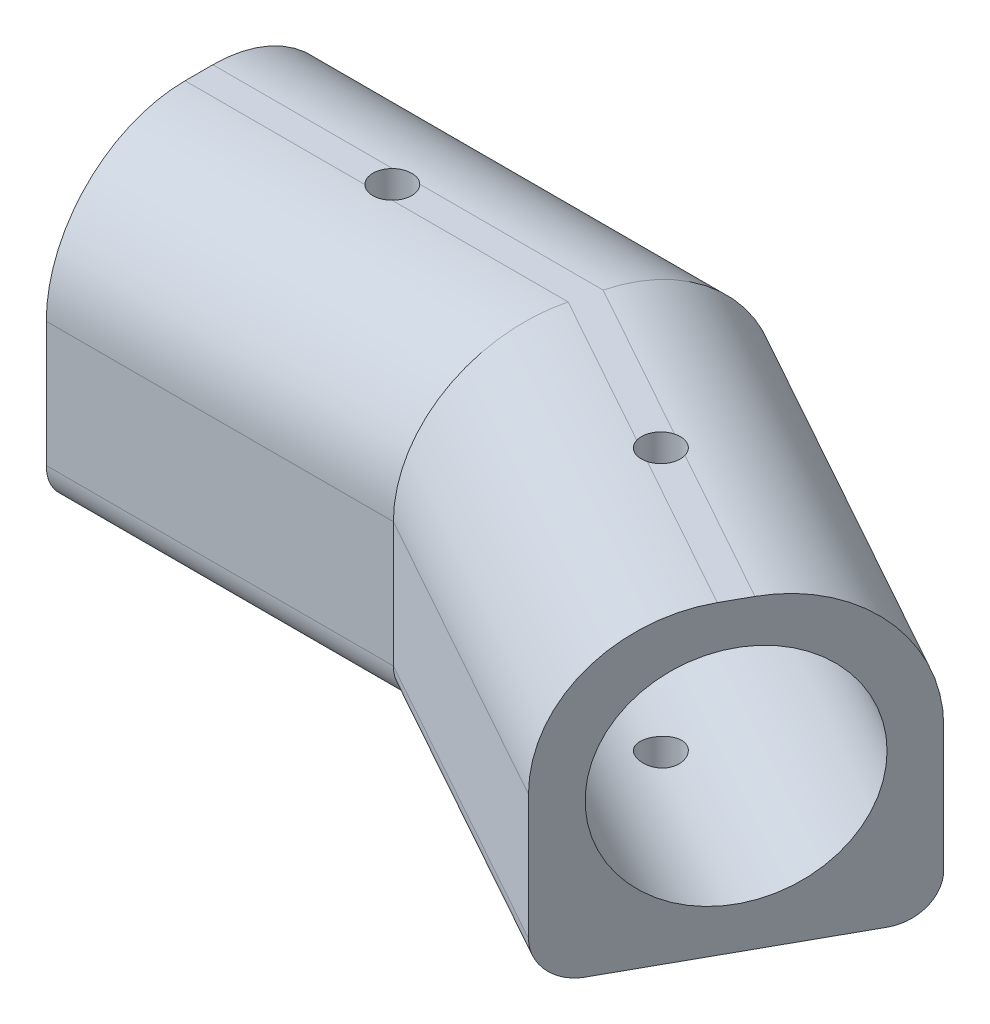
from build123d import *

# Parameters (mm, degrees)
BOSS_EXTRUDE3_DEPTH = 22
CUT_EXTRUDE4_DEPTH  = 59.108375
CUT_EXTRUDE5_REACH  = 125.396
SKETCH5_R           = 8
CUT_EXTRUDE6_REACH  = 125.396
SKETCH7_R           = 8
FILLET1_R           = 10
CUT_EXTRUDE9_DEPTH  = 28.41
CUT_EXTRUDE10_DEPTH = 33.85
BOSS_EXTRUDE4_REACH = 60.461
BOSS_EXTRUDE5_REACH = 60.461
BOSS_EXTRUDE6_REACH = 60.461
BOSS_EXTRUDE7_REACH = 60.461
CUT_EXTRUDE11_DEPTH = 40
FILLET2_R           = 3


with BuildPart() as part:
    # Sketch1 → Boss-Extrude3 (new body)
    with BuildSketch(Plane(origin=(0, 0, 0), x_dir=(1, 0, 0), z_dir=(0, 1, 0))):
        Polygon((36.111730264, -52.557630883), (46.787036785, -33.321263484), (-9.652310469, -2), (-68.760685704, -2), (-68.760685704, -24), (-15.347689531, -24), align=None)
    extrude(amount=BOSS_EXTRUDE3_DEPTH)

    # Sketch4 → Cut-Extrude4 (cut)
    with BuildSketch(Plane.ZY.offset(68.760685704)):
        with BuildLine():
            ThreePointArc((21, 11), (13, 19), (5, 11))
            Line((5, 11), (21, 11))
        make_face()
        with BuildLine():
            Line((21, 11), (5, 11))
            ThreePointArc((5, 11), (13, 3), (21, 11))
        make_face()
    extrude(amount=-CUT_EXTRUDE4_DEPTH, mode=Mode.SUBTRACT)

    # Cut-Extrude5: up to this plane
    cut_extrude5_end = Plane(origin=(-9.652310469, 0, 0), z_dir=(-1, 0, 0))
    # Sketch5 → Cut-Extrude5 (cut, up to the surface)
    with BuildSketch(Plane(origin=(49.908331158, 0, 27.696847436), x_dir=(0.4852412054872001, 0, -0.87438033629384), z_dir=(0.87438033629384, 0, 0.4852412054872001)), mode=Mode.PRIVATE) as cut_extrude5_sk1:
        with Locations((-17.43245944, 11)):
            Circle(SKETCH5_R)
    cut_extrude5_tool1 = split(extrude(cut_extrude5_sk1.sketch, amount=-CUT_EXTRUDE5_REACH, mode=Mode.PRIVATE), bisect_by=cut_extrude5_end, keep=Keep.BOTH, mode=Mode.PRIVATE)
    add(cut_extrude5_tool1.solids().sort_by_distance((41.449384, 11, 42.939447))[0], mode=Mode.SUBTRACT)

    # Sketch7 → Cut-Extrude6 (cut, up to next)
    with BuildSketch(Plane(origin=(49.908331158, 0, 27.696847436), x_dir=(0.4852412054872001, 0, -0.87438033629384), z_dir=(0.87438033629384, 0, 0.4852412054872001)), mode=Mode.PRIVATE) as cut_extrude6_sk1:
        with Locations((-17.43245944, 11)):
            Circle(SKETCH7_R)
    cut_extrude6_tool1 = extrude(cut_extrude6_sk1.sketch, amount=-CUT_EXTRUDE6_REACH, mode=Mode.PRIVATE) & part.part
    add(cut_extrude6_tool1.solids().sort_by_distance((41.449384, 11, 42.939447))[0], mode=Mode.SUBTRACT)

    # Fillet1
    fillet1_edges = [part.edges().sort_by_distance(p)[0] for p in [
        (18.567363158, 0, 17.660631742),
        (10.382020367, 0, 38.278815441),
        (18.567363158, 22, 17.660631742),
        (-39.206498086, 22, 2),
        (-42.054187617, 22, 24),
        (10.382020367, 22, 38.278815441),
        (-42.054187617, 0, 24),
        (-39.206498086, 0, 2),
    ]]
    fillet(fillet1_edges, radius=FILLET1_R)

    # Sketch9 → Cut-Extrude9 (cut)
    with BuildSketch(Plane.ZY.offset(68.760685704)):
        with BuildLine():
            Line((2, 12), (2, 10))
            ThreePointArc((2, 10), (4.928932188, 2.928932188), (12, 0))
            Line((12, 0), (14, 0))
            ThreePointArc((14, 0), (21.071067812, 2.928932188), (24, 10))
            Line((24, 10), (24, 12))
            ThreePointArc((24, 12), (21.071067812, 19.071067812), (14, 22))
            Line((14, 22), (12, 22))
            ThreePointArc((12, 22), (4.928932188, 19.071067812), (2, 12))
        make_face()
    extrude(amount=-CUT_EXTRUDE9_DEPTH, mode=Mode.SUBTRACT)

    # Sketch10 → Cut-Extrude10 (cut)
    with BuildSketch(Plane(origin=(49.908331158, 0, 27.696847436), x_dir=(0.4852412054872001, 0, -0.87438033629384), z_dir=(0.87438033629384, 0, 0.4852412054872001))):
        with BuildLine():
            Line((-18.43245944, 0), (-16.43245944, 0))
            ThreePointArc((-16.43245944, 0), (-9.361391629, 2.928932188), (-6.43245944, 10))
            Line((-6.43245944, 10), (-6.43245944, 12))
            ThreePointArc((-6.43245944, 12), (-9.361391629, 19.071067812), (-16.43245944, 22))
            Line((-16.43245944, 22), (-18.43245944, 22))
            ThreePointArc((-18.43245944, 22), (-25.503527252, 19.071067812), (-28.43245944, 12))
            Line((-28.43245944, 12), (-28.43245944, 10))
            ThreePointArc((-28.43245944, 10), (-25.503527252, 2.928932188), (-18.43245944, 0))
        make_face()
    extrude(amount=-CUT_EXTRUDE10_DEPTH, mode=Mode.SUBTRACT)

    # Sketch11 → Boss-Extrude4 (add, up to next)
    with BuildSketch(Plane.XZ, mode=Mode.PRIVATE) as boss_extrude4_sk1:
        Polygon((-15.347689531, 24), (-40.350685704, 24), (-40.350685704, 14), (-12.758880866, 14), align=None)
    boss_extrude4_tool1 = extrude(boss_extrude4_sk1.sketch, amount=-BOSS_EXTRUDE4_REACH, mode=Mode.PRIVATE) - part.part
    add(boss_extrude4_tool1.solids().sort_by_distance((-27.191367, 0, 18.917964))[0])

    # Sketch12 → Boss-Extrude5 (add, up to next)
    with BuildSketch(Plane.XZ, mode=Mode.PRIVATE) as boss_extrude5_sk1:
        Polygon((6.513955881, 36.132216077), (-15.347689531, 24), (-12.758880866, 14), (11.366367936, 27.388412714), align=None)
    boss_extrude5_tool1 = extrude(boss_extrude5_sk1.sketch, amount=-BOSS_EXTRUDE5_REACH, mode=Mode.PRIVATE) - part.part
    add(boss_extrude5_tool1.solids().sort_by_distance((-2.526039, 0, 25.303272))[0])

    # Sketch13 → Boss-Extrude6 (add, up to next)
    with BuildSketch(Plane.XZ, mode=Mode.PRIVATE) as boss_extrude6_sk1:
        Polygon((-40.350685704, 12), (-12.241119134, 12), (-9.652310469, 2), (-40.350685704, 2), align=None)
    boss_extrude6_tool1 = extrude(boss_extrude6_sk1.sketch, amount=-BOSS_EXTRUDE6_REACH, mode=Mode.PRIVATE) - part.part
    add(boss_extrude6_tool1.solids().sort_by_distance((-25.639203, 0, 6.926631))[0])

    # Sketch14 → Boss-Extrude7 (add, up to next)
    with BuildSketch(Plane.XZ, mode=Mode.PRIVATE) as boss_extrude7_sk1:
        Polygon((-12.241119134, 12), (12.336850347, 25.639652042), (17.189262401, 16.895848679), (-9.652310469, 2), align=None)
    boss_extrude7_tool1 = extrude(boss_extrude7_sk1.sketch, amount=-BOSS_EXTRUDE7_REACH, mode=Mode.PRIVATE) - part.part
    add(boss_extrude7_tool1.solids().sort_by_distance((1.935469, 0, 14.065113))[0])

    # Sketch15 → Cut-Extrude11 (cut)
    with BuildSketch(Plane.XZ):
        with BuildLine():
            ThreePointArc((-27.825342852, 13), (-26.425342852, 11.6), (-25.025342852, 13))
            Line((-25.025342852, 13), (-27.825342852, 13))
        make_face()
        with BuildLine():
            Line((-27.825342852, 13), (-25.025342852, 13))
            ThreePointArc((-25.025342852, 13), (-26.425342852, 14.4), (-27.825342852, 13))
        make_face()
        with BuildLine():
            ThreePointArc((0.899937041, 20.436353877), (-1.003533117, 20.98114866), (-1.5483279, 19.077678501))
            Line((-1.5483279, 19.077678501), (0.899937041, 20.436353877))
        make_face()
        with BuildLine():
            Line((0.899937041, 20.436353877), (-1.5483279, 19.077678501))
            ThreePointArc((-1.5483279, 19.077678501), (0.026671027, 18.401696031), (1.075804571, 19.757016189))
            ThreePointArc((1.075804571, 19.757016189), (1.031124728, 20.107882646), (0.899937041, 20.436353877))
        make_face()
    extrude(amount=-CUT_EXTRUDE11_DEPTH, mode=Mode.SUBTRACT)

    # Fillet2
    fillet2_edges = [part.edges().sort_by_distance(p)[0] for p in [
        (-27.849187617, 0, 24),
        (-4.416866825, 0, 30.066108039),
        (-25.001498086, 0, 2),
        (3.768475966, 0, 9.447924339),
    ]]
    fillet(fillet2_edges, radius=FILLET2_R)


solid = part.part
